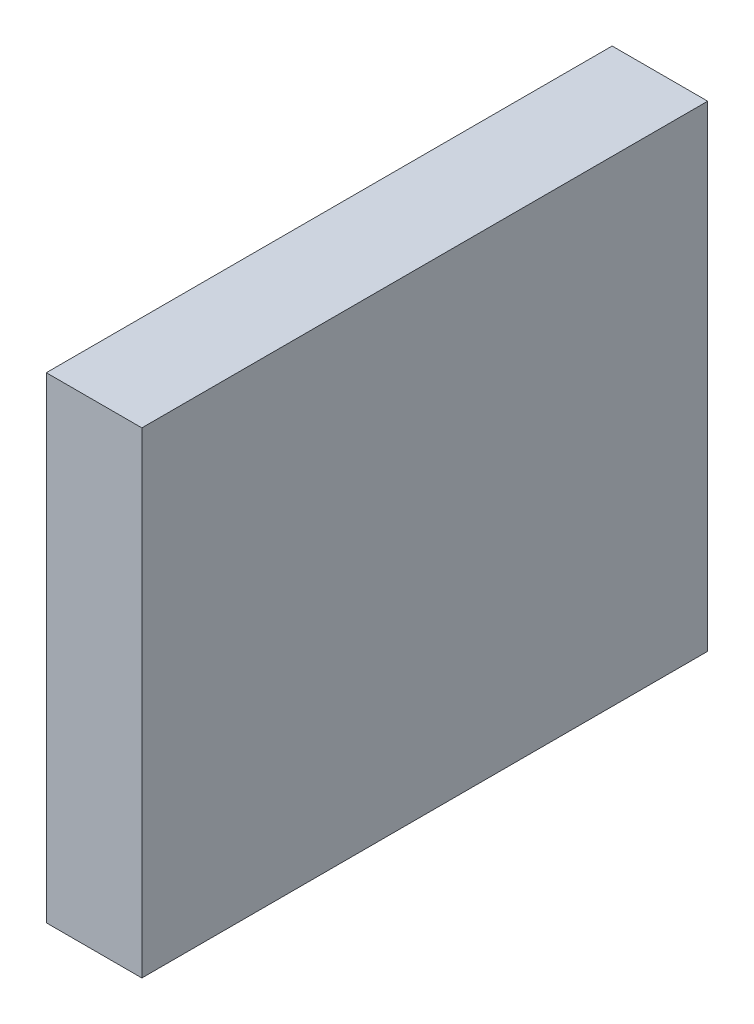
from build123d import *

# Parameters (mm, degrees)
SKETCH1_W           = 17.8
SKETCH1_H           = 21.14
BOSS_EXTRUDE1_DEPTH = 3.57


with BuildPart() as part:
    # Sketch1 → Boss-Extrude1 (new body)
    with BuildSketch(Plane.YZ):
        Rectangle(SKETCH1_W, SKETCH1_H)
    extrude(amount=BOSS_EXTRUDE1_DEPTH)


solid = part.part
